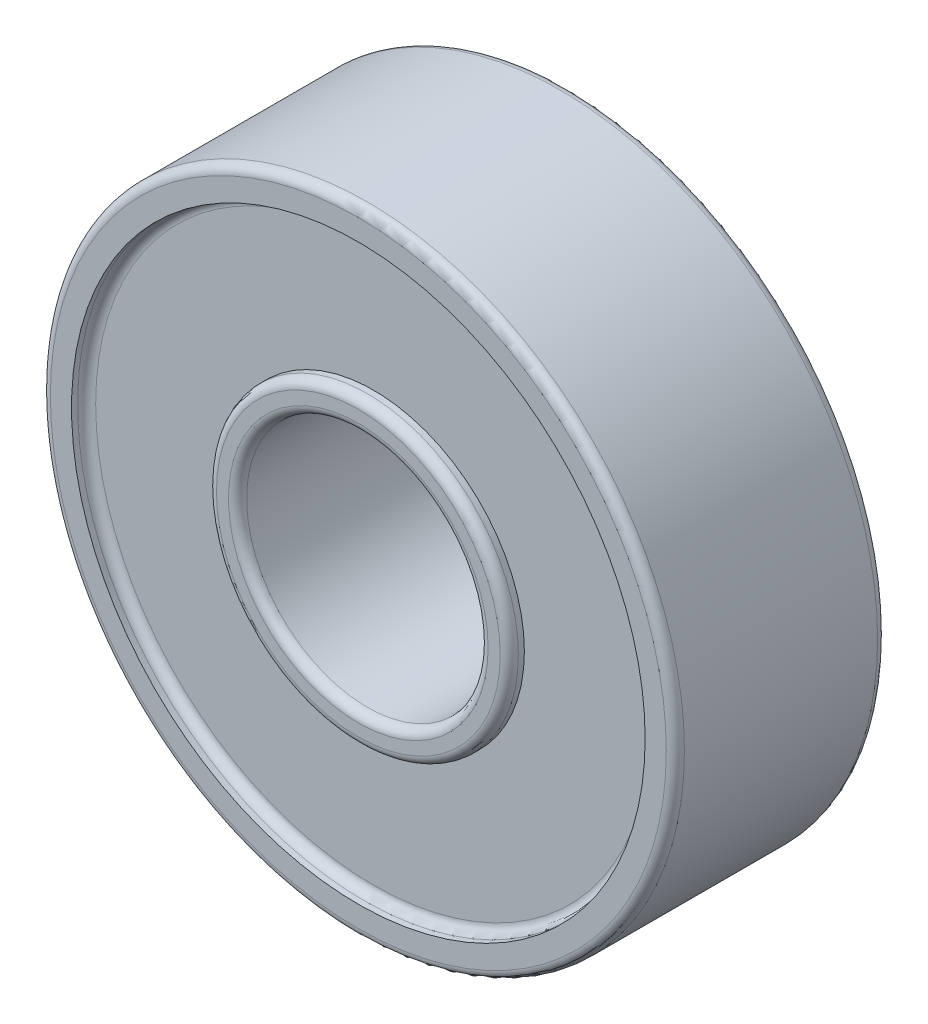
from build123d import *

# Parameters (mm, degrees)
CROQUIS1_R              = 5
CROQUIS1_R_2            = 4
SALIENTE_EXTRUIR1_DEPTH = 7
SALIENTE_EXTRUIR2_START = -6.5
CROQUIS2_R              = 9.5
CROQUIS2_R_2            = 5
SALIENTE_EXTRUIR2_DEPTH = 6
SALIENTE_EXTRUIR3_START = -7
CROQUIS3_R              = 10.5
CROQUIS3_R_2            = 9.5
SALIENTE_EXTRUIR3_DEPTH = 7
REDONDEO1_R             = 0.3


with BuildPart() as part:
    # Croquis1 → Saliente-Extruir1 (new body)
    with BuildSketch(Plane.XY):
        Circle(CROQUIS1_R)
        Circle(CROQUIS1_R_2, mode=Mode.SUBTRACT)
    extrude(amount=SALIENTE_EXTRUIR1_DEPTH)

    # Croquis2 → Saliente-Extruir2 (add)
    with BuildSketch(Plane.XY.offset(7).offset(SALIENTE_EXTRUIR2_START)):
        Circle(CROQUIS2_R)
        Circle(CROQUIS2_R_2, mode=Mode.SUBTRACT)
    extrude(amount=SALIENTE_EXTRUIR2_DEPTH)

    # Croquis3 → Saliente-Extruir3 (add)
    with BuildSketch(Plane.XY.offset(7).offset(SALIENTE_EXTRUIR3_START)):
        Circle(CROQUIS3_R)
        Circle(CROQUIS3_R_2, mode=Mode.SUBTRACT)
    extrude(amount=SALIENTE_EXTRUIR3_DEPTH)

    # Redondeo1
    redondeo1_edges = [part.edges().sort_by_distance(p)[0] for p in [
        (-9.5, 0, 6.5),
        (-10.5, 0, 0),
        (-9.5, 0, 0),
        (-10.5, 0, 7),
        (-5, 0, 0),
        (-5, 0, 7),
        (-4, 0, 0),
        (-4, 0, 7),
    ]]
    fillet(redondeo1_edges, radius=REDONDEO1_R)


solid = part.part
